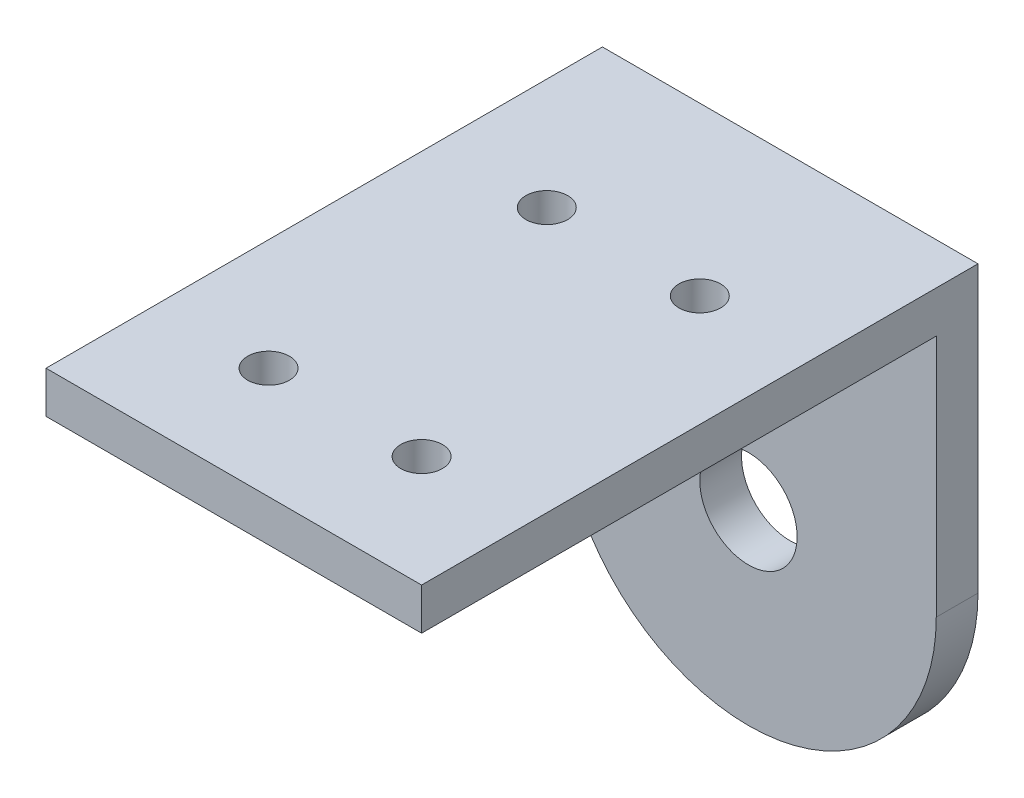
from build123d import *

# Parameters (mm, degrees)
MODEL_R             = 3.5
EXTRUDE_1_DEPTH     = 40
SKETCH_3_W          = 37
SKETCH_3_H          = 37
CUT_EXTRUDE_1_DEPTH = 40
SKETCH_4_R          = 1.5
CUT_EXTRUDE_2_DEPTH = 40


with BuildPart() as part:
    # Model → 凸台-拉伸1 (new body)
    with BuildSketch(Plane.XY):
        with BuildLine():
            Line((2619.766714505, 1592.826425633), (2619.766714505, 1613.326425633))
            Line((2619.766714505, 1613.326425633), (2592.766714505, 1613.326425633))
            Line((2592.766714505, 1613.326425633), (2592.766714505, 1592.826425633))
            ThreePointArc((2592.766714505, 1592.826425633), (2606.266714505, 1579.326425633), (2619.766714505, 1592.826425633))
        make_face()
        with Locations((2606.266714505, 1592.826425633)):
            Circle(MODEL_R, mode=Mode.SUBTRACT)
    extrude(amount=EXTRUDE_1_DEPTH)

    # 草图3 → 切除-拉伸1 (cut)
    with BuildSketch(Plane(origin=(2619.766714505, 0, 0), x_dir=(0, 0, -1), z_dir=(1, 0, 0))):
        with Locations((-21.5, 1591.826425633)):
            Rectangle(SKETCH_3_W, SKETCH_3_H)
    extrude(amount=-CUT_EXTRUDE_1_DEPTH, mode=Mode.SUBTRACT)

    # 草图4 → 切除-拉伸2 (cut)
    with BuildSketch(Plane(origin=(0, 1613.326425633, 0), x_dir=(1, 0, 0), z_dir=(0, 1, 0))):
        with Locations(Location((2600.766714505, -32, 0), (0, 0, 270))):
            Circle(SKETCH_4_R)
        with Locations(Location((2611.766714505, -32, 0), (0, 0, 270))):
            Circle(SKETCH_4_R)
        with Locations(Location((2600.766714505, -12, 0), (0, 0, 270))):
            Circle(SKETCH_4_R)
        with Locations(Location((2611.766714505, -12, 0), (0, 0, 270))):
            Circle(SKETCH_4_R)
    extrude(amount=-CUT_EXTRUDE_2_DEPTH, mode=Mode.SUBTRACT)


solid = part.part
